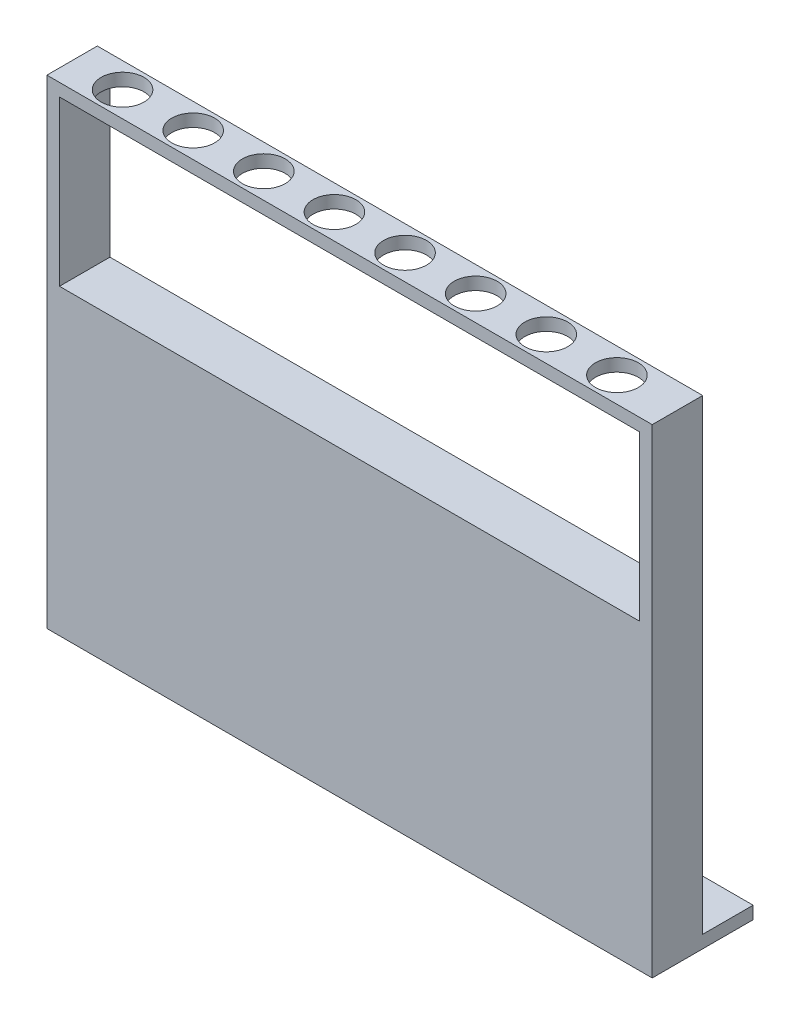
from build123d import *

# Parameters (mm, degrees)
SKETCH1_W           = 152.4
SKETCH1_H           = 12.7
BOSS_EXTRUDE1_DEPTH = 76.2
SKETCH2_R           = 3.175
BOSS_EXTRUDE4_DEPTH = 3.175
BOSS_EXTRUDE5_DEPTH = 12.7
CUT_EXTRUDE1_REACH  = 145.964
SKETCH4_R           = 5.3975


with BuildPart() as part:
    # Sketch1 → Boss-Extrude1 (new body)
    with BuildSketch(Plane(origin=(0, 0, 0), x_dir=(1, 0, 0), z_dir=(0, 1, 0))):
        Rectangle(SKETCH1_W, SKETCH1_H)
    extrude(amount=BOSS_EXTRUDE1_DEPTH)

    # Sketch2 → Boss-Extrude4 (add)
    with BuildSketch(Plane(origin=(0, 0, 0), x_dir=(1, 0, 0), z_dir=(0, 1, 0))):
        Polygon((-76.2, 12.7), (-76.2, 6.35), (76.2, 6.35), (76.2, 19.05), (-76.2, 19.05), align=None)
        with Locations(Location((-69.85, 12.7, 0), (0, 0, 270))):
            Circle(SKETCH2_R, mode=Mode.SUBTRACT)
        with Locations(Location((-44.45, 12.7, 0), (0, 0, 270))):
            Circle(SKETCH2_R, mode=Mode.SUBTRACT)
        with Locations(Location((-19.05, 12.7, 0), (0, 0, 270))):
            Circle(SKETCH2_R, mode=Mode.SUBTRACT)
        with Locations(Location((6.35, 12.7, 0), (0, 0, 270))):
            Circle(SKETCH2_R, mode=Mode.SUBTRACT)
        with Locations(Location((31.75, 12.7, 0), (0, 0, 270))):
            Circle(SKETCH2_R, mode=Mode.SUBTRACT)
        with Locations(Location((57.15, 12.7, 0), (0, 0, 270))):
            Circle(SKETCH2_R, mode=Mode.SUBTRACT)
    extrude(amount=BOSS_EXTRUDE4_DEPTH)

    # Sketch3 → Boss-Extrude5 (add)
    with BuildSketch(Plane.XY.offset(6.35)):
        Polygon((-76.2, 76.2), (-76.2, 120.65), (76.2, 120.65), (76.2, 76.2), (73.025, 76.2), (73.025, 117.475), (-73.025, 117.475), (-73.025, 76.2), align=None)
    extrude(amount=-BOSS_EXTRUDE5_DEPTH)

    # Sketch4 → Cut-Extrude1 (cut, up to next)
    with BuildSketch(Plane(origin=(0, 120.65, 0), x_dir=(1, 0, 0), z_dir=(0, 1, 0)), mode=Mode.PRIVATE) as cut_extrude1_sk1:
        with Locations(Location((-63.5, 0, 0), (0, 0, 270))):
            Circle(SKETCH4_R)
    cut_extrude1_tool1 = extrude(cut_extrude1_sk1.sketch, amount=-CUT_EXTRUDE1_REACH, mode=Mode.PRIVATE) & part.part
    # Sketch4 → Cut-Extrude1 (cut, up to next)
    with BuildSketch(Plane(origin=(0, 120.65, 0), x_dir=(1, 0, 0), z_dir=(0, 1, 0)), mode=Mode.PRIVATE) as cut_extrude1_sk2:
        with Locations(Location((-45.72, 0, 0), (0, 0, 270))):
            Circle(SKETCH4_R)
    cut_extrude1_tool2 = extrude(cut_extrude1_sk2.sketch, amount=-CUT_EXTRUDE1_REACH, mode=Mode.PRIVATE) & part.part
    # Sketch4 → Cut-Extrude1 (cut, up to next)
    with BuildSketch(Plane(origin=(0, 120.65, 0), x_dir=(1, 0, 0), z_dir=(0, 1, 0)), mode=Mode.PRIVATE) as cut_extrude1_sk3:
        with Locations(Location((-27.94, 0, 0), (0, 0, 270))):
            Circle(SKETCH4_R)
    cut_extrude1_tool3 = extrude(cut_extrude1_sk3.sketch, amount=-CUT_EXTRUDE1_REACH, mode=Mode.PRIVATE) & part.part
    # Sketch4 → Cut-Extrude1 (cut, up to next)
    with BuildSketch(Plane(origin=(0, 120.65, 0), x_dir=(1, 0, 0), z_dir=(0, 1, 0)), mode=Mode.PRIVATE) as cut_extrude1_sk4:
        with Locations(Location((-10.16, 0, 0), (0, 0, 270))):
            Circle(SKETCH4_R)
    cut_extrude1_tool4 = extrude(cut_extrude1_sk4.sketch, amount=-CUT_EXTRUDE1_REACH, mode=Mode.PRIVATE) & part.part
    # Sketch4 → Cut-Extrude1 (cut, up to next)
    with BuildSketch(Plane(origin=(0, 120.65, 0), x_dir=(1, 0, 0), z_dir=(0, 1, 0)), mode=Mode.PRIVATE) as cut_extrude1_sk5:
        with Locations(Location((7.62, 0, 0), (0, 0, 270))):
            Circle(SKETCH4_R)
    cut_extrude1_tool5 = extrude(cut_extrude1_sk5.sketch, amount=-CUT_EXTRUDE1_REACH, mode=Mode.PRIVATE) & part.part
    # Sketch4 → Cut-Extrude1 (cut, up to next)
    with BuildSketch(Plane(origin=(0, 120.65, 0), x_dir=(1, 0, 0), z_dir=(0, 1, 0)), mode=Mode.PRIVATE) as cut_extrude1_sk6:
        with Locations(Location((25.4, 0, 0), (0, 0, 270))):
            Circle(SKETCH4_R)
    cut_extrude1_tool6 = extrude(cut_extrude1_sk6.sketch, amount=-CUT_EXTRUDE1_REACH, mode=Mode.PRIVATE) & part.part
    # Sketch4 → Cut-Extrude1 (cut, up to next)
    with BuildSketch(Plane(origin=(0, 120.65, 0), x_dir=(1, 0, 0), z_dir=(0, 1, 0)), mode=Mode.PRIVATE) as cut_extrude1_sk7:
        with Locations(Location((43.18, 0, 0), (0, 0, 270))):
            Circle(SKETCH4_R)
    cut_extrude1_tool7 = extrude(cut_extrude1_sk7.sketch, amount=-CUT_EXTRUDE1_REACH, mode=Mode.PRIVATE) & part.part
    # Sketch4 → Cut-Extrude1 (cut, up to next)
    with BuildSketch(Plane(origin=(0, 120.65, 0), x_dir=(1, 0, 0), z_dir=(0, 1, 0)), mode=Mode.PRIVATE) as cut_extrude1_sk8:
        with Locations(Location((60.96, 0, 0), (0, 0, 270))):
            Circle(SKETCH4_R)
    cut_extrude1_tool8 = extrude(cut_extrude1_sk8.sketch, amount=-CUT_EXTRUDE1_REACH, mode=Mode.PRIVATE) & part.part
    add(cut_extrude1_tool1.solids().sort_by_distance((-63.5, 120.65, 0))[0], mode=Mode.SUBTRACT)
    add(cut_extrude1_tool2.solids().sort_by_distance((-45.72, 120.65, 0))[0], mode=Mode.SUBTRACT)
    add(cut_extrude1_tool3.solids().sort_by_distance((-27.94, 120.65, 0))[0], mode=Mode.SUBTRACT)
    add(cut_extrude1_tool4.solids().sort_by_distance((-10.16, 120.65, 0))[0], mode=Mode.SUBTRACT)
    add(cut_extrude1_tool5.solids().sort_by_distance((7.62, 120.65, 0))[0], mode=Mode.SUBTRACT)
    add(cut_extrude1_tool6.solids().sort_by_distance((25.4, 120.65, 0))[0], mode=Mode.SUBTRACT)
    add(cut_extrude1_tool7.solids().sort_by_distance((43.18, 120.65, 0))[0], mode=Mode.SUBTRACT)
    add(cut_extrude1_tool8.solids().sort_by_distance((60.96, 120.65, 0))[0], mode=Mode.SUBTRACT)


solid = part.part
